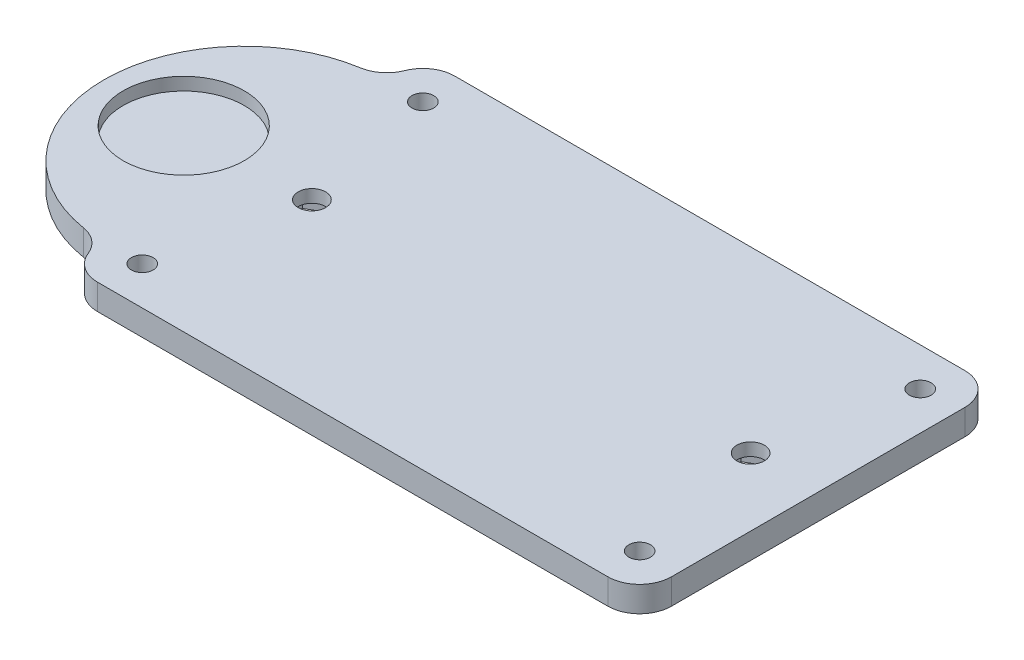
from build123d import *

# Parameters (mm, degrees)
SKETCH1_W           = 90
SKETCH1_H           = 56
BOSS_EXTRUDE1_DEPTH = 4
SKETCH2_R           = 2.15
SKETCH2_R_2         = 1.7
CUT_EXTRUDE1_DEPTH  = 4
CUT_EXTRUDE2_DEPTH  = 2
BOSS_EXTRUDE3_DEPTH = 4
SKETCH6_R           = 9.5
CUT_EXTRUDE3_DEPTH  = 2
FILLET1_R           = 5
FILLET2_R           = 5


with BuildPart() as part:
    # Sketch1 → Boss-Extrude1 (new body)
    with BuildSketch(Plane(origin=(0, 0, 0), x_dir=(1, 0, 0), z_dir=(0, 1, 0))):
        Rectangle(SKETCH1_W, SKETCH1_H)
    extrude(amount=BOSS_EXTRUDE1_DEPTH)

    # Sketch2 → Cut-Extrude1 (cut)
    with BuildSketch(Plane(origin=(0, 4, 0), x_dir=(1, 0, 0), z_dir=(0, 1, 0))):
        with Locations(Location((-34.4, 0, 0), (0, 0, 270))):
            Circle(SKETCH2_R)
        with Locations(Location((34.4, 0, 0), (0, 0, 270))):
            Circle(SKETCH2_R)
        with Locations(Location((-39.002290859, -22, 0), (0, 0, 270))):
            Circle(SKETCH2_R_2)
        with Locations(Location((39, -22, 0), (0, 0, 270))):
            Circle(SKETCH2_R_2)
        with Locations(Location((39, 22, 0), (0, 0, 270))):
            Circle(SKETCH2_R_2)
        with Locations(Location((-39, 22, 0), (0, 0, 270))):
            Circle(SKETCH2_R_2)
    extrude(amount=-CUT_EXTRUDE1_DEPTH, mode=Mode.SUBTRACT)

    # Sketch3 → Cut-Extrude2 (cut)
    with BuildSketch(Plane.XZ):
        Polygon((30.825, -2.064027212), (34.4, -4.128054425), (37.975, -2.064027212), (37.975, 2.064027212), (34.4, 4.128054425), (30.825, 2.064027212), align=None)
        Polygon((-37.975, -2.064027212), (-34.4, -4.128054425), (-30.825, -2.064027212), (-30.825, 2.064027212), (-34.4, 4.128054425), (-37.975, 2.064027212), align=None)
    extrude(amount=-CUT_EXTRUDE2_DEPTH, mode=Mode.SUBTRACT)

    # Sketch4 → Boss-Extrude3 (add)
    with BuildSketch(Plane(origin=(0, 4, 0), x_dir=(1, 0, 0), z_dir=(0, 1, 0))):
        with BuildLine():
            Line((-45, -22), (-45, 22))
            ThreePointArc((-45, 22), (-67, 0), (-45, -22))
        make_face()
    extrude(amount=-BOSS_EXTRUDE3_DEPTH)

    # Sketch6 → Cut-Extrude3 (cut)
    with BuildSketch(Plane(origin=(0, 4, 0), x_dir=(1, 0, 0), z_dir=(0, 1, 0))):
        with Locations(Location((-54.5, 0, 0), (0, 0, 270))):
            Circle(SKETCH6_R)
    extrude(amount=-CUT_EXTRUDE3_DEPTH, mode=Mode.SUBTRACT)

    # Fillet1
    fillet1_edges = [part.edges().sort_by_distance(p)[0] for p in [
        (-45, 2, -28),
        (45, 2, -28),
        (45, 2, 28),
        (-45, 2, 28),
    ]]
    fillet(fillet1_edges, radius=FILLET1_R)

    # Fillet2
    fillet2_edges = [part.edges().sort_by_distance(p)[0] for p in [
        (-45, 2, -22),
        (-45, 2, 22),
    ]]
    fillet(fillet2_edges, radius=FILLET2_R)


solid = part.part
